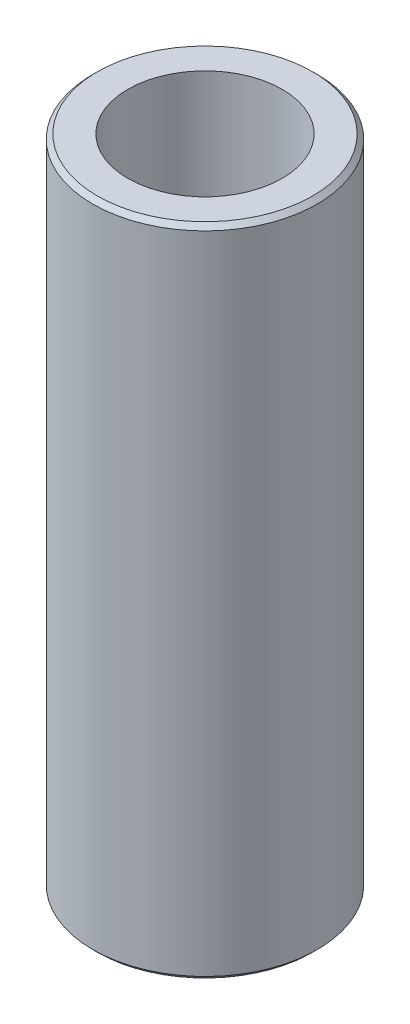
from build123d import *

# Parameters (mm, degrees)
IZIM1_R                     = 2.4
IZIM1_R_2                   = 1.65
Y_KSEKLIK_EKSTR_ZYON1_DEPTH = 14
PAH1_SIZE                   = 0.1


with BuildPart() as part:
    # Çizim1 → Yükseklik-Ekstrüzyon1 (new body)
    with BuildSketch(Plane(origin=(0, 0, 0), x_dir=(1, 0, 0), z_dir=(0, 1, 0))):
        with Locations(Location((0, 0, 0), (0, 0, 270))):
            Circle(IZIM1_R)
        with Locations(Location((0, 0, 0), (0, 0, 270))):
            Circle(IZIM1_R_2, mode=Mode.SUBTRACT)
    extrude(amount=Y_KSEKLIK_EKSTR_ZYON1_DEPTH)

    # Pah1
    pah1_edges = [part.edges().sort_by_distance(p)[0] for p in [
        (0, 0, -2.4),
        (0, 14, -2.4),
    ]]
    chamfer(pah1_edges, length=PAH1_SIZE)


solid = part.part
